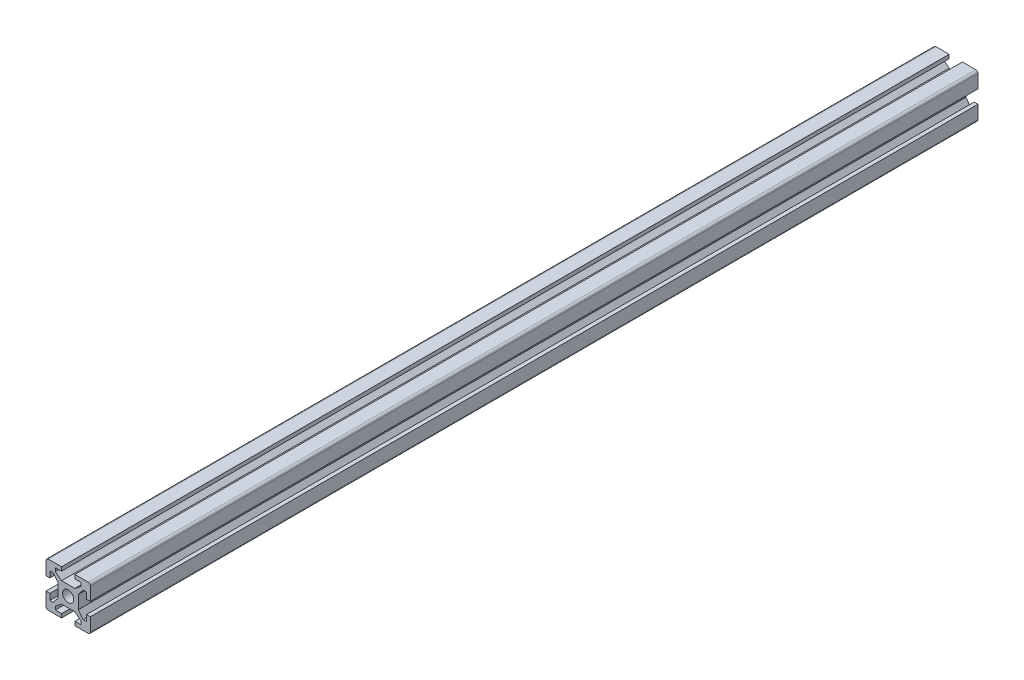
from build123d import *

# Parameters (mm, degrees)
BOSS_EXTRUDE1_DEPTH     = 200
CUT_EXTRUDE1_DEPTH      = 401.249921924
CUT_EXTRUDE1_DEPTH_BACK = 401.249921924
SKETCH2_R               = 2.5
FILLET1_R               = 1


with BuildPart() as part:
    # Sketch1 → Boss-Extrude1 (new, symmetric)
    with BuildSketch(Plane.XY):
        Polygon((-10, 10), (-3, 10), (-3, 8.272610059), (-5.783778863, 8.272610059), (-5.783778863, 6.747994248), (-3, 4.550753814), (3, 4.550753814), (5.783778863, 6.747994248), (5.783778863, 8.272610059), (3, 8.272610059), (3, 10), (10, 10), (10, 3), (8.272610059, 3), (8.272610059, 5.783778863), (6.747994248, 5.783778863), (4.55, 3.000595152), (4.55, -2.999404848), (6.747994248, -5.783778863), (8.272610059, -5.783778863), (8.272610059, -3), (10, -3), (10, -10), (3, -10), (3, -8.272610059), (5.783778863, -8.272610059), (5.783778863, -6.747994248), (2.999404848, -4.55), (-3.000595152, -4.55), (-5.783778863, -6.747994248), (-5.783778863, -8.272610059), (-3, -8.272610059), (-3, -10), (-10, -10), (-10, -3), (-8.272610059, -3), (-8.272610059, -5.783778863), (-6.747994248, -5.783778863), (-4.55, -3.000595152), (-4.55, 2.999404848), (-6.747994248, 5.783778863), (-8.272610059, 5.783778863), (-8.272610059, 3), (-10, 3), align=None)
    extrude(amount=BOSS_EXTRUDE1_DEPTH, both=True)

    # Sketch2 → Cut-Extrude1 (cut, two sides: drawn at the far end of the back side and taken through both)
    with BuildSketch(Plane.XY.offset(200).offset(-CUT_EXTRUDE1_DEPTH_BACK)):
        Circle(SKETCH2_R)
    extrude(amount=CUT_EXTRUDE1_DEPTH + CUT_EXTRUDE1_DEPTH_BACK, mode=Mode.SUBTRACT)

    # Fillet1
    fillet1_edges = [part.edges().sort_by_distance(p)[0] for p in [
        (-10, 10, 0),
        (10, 10, 0),
        (10, -10, 0),
        (-10, -10, 0),
    ]]
    fillet(fillet1_edges, radius=FILLET1_R)


solid = part.part
